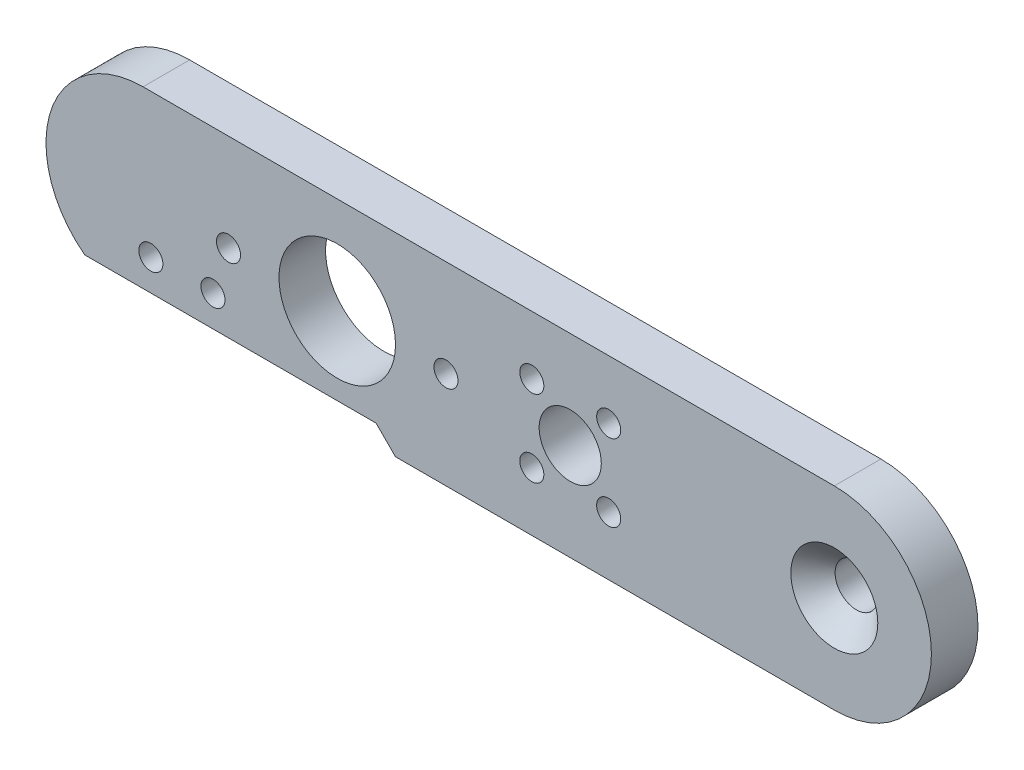
from build123d import *

# Parameters (mm, degrees)
SKETCH2_R                     = 4
SKETCH2_R_2                   = 1.55
SKETCH2_R_3                   = 7.5
BOSS_EXTRUDE1_DEPTH           = 6
CSK_FOR_M5_SFHCS1_D           = 5.5
CSK_FOR_M5_SFHCS1_CSINK_D     = 11.2
CSK_FOR_M5_SFHCS1_CSINK_ANGLE = 90
SKETCH6_R                     = 1.55
CUT_EXTRUDE1_DEPTH            = 3
SKETCH7_R                     = 3
CUT_EXTRUDE2_DEPTH            = 59.49909717


with BuildPart() as part:
    # Sketch2 → Boss-Extrude1 (new body)
    with BuildSketch(Plane.XY):
        with BuildLine():
            Line((-44.569206843, 12.5), (44.430793157, 12.5))
            ThreePointArc((44.430793157, 12.5), (56.930793157, 0), (44.430793157, -12.5))
            Line((44.430793157, -12.5), (-12.069206843, -12.5))
            Line((-12.069206843, -12.5), (-14.569206843, -10))
            Line((-14.569206843, -10), (-52.069206843, -10))
            ThreePointArc((-52.069206843, -10), (-56.427748069, 3.952847075), (-44.569206843, 12.5))
        make_face()
        with Locations((10.430793157, 0)):
            Circle(SKETCH2_R, mode=Mode.SUBTRACT)
        with Locations((15.380540625, 4.949747468)):
            Circle(SKETCH2_R_2, mode=Mode.SUBTRACT)
        with Locations((15.380540625, -4.949747468)):
            Circle(SKETCH2_R_2, mode=Mode.SUBTRACT)
        with Locations((5.481045689, -4.949747468)):
            Circle(SKETCH2_R_2, mode=Mode.SUBTRACT)
        with Locations((5.481045689, 4.949747468)):
            Circle(SKETCH2_R_2, mode=Mode.SUBTRACT)
        with Locations((-19.569206843, 0)):
            Circle(SKETCH2_R_3, mode=Mode.SUBTRACT)
        with Locations((-5.569206843, 0)):
            Circle(SKETCH2_R_2, mode=Mode.SUBTRACT)
        with Locations((-33.569206843, 0)):
            Circle(SKETCH2_R_2, mode=Mode.SUBTRACT)
    extrude(amount=BOSS_EXTRUDE1_DEPTH)

    # CSK for M5 SFHCS1 (through all)
    with Locations(Plane(origin=(44.430793157, 0, 6), x_dir=(1, 0, 0), z_dir=(0, 0, 1))):
        with Locations((0, 0)):
            CounterSinkHole(CSK_FOR_M5_SFHCS1_D / 2, CSK_FOR_M5_SFHCS1_CSINK_D / 2, counter_sink_angle=CSK_FOR_M5_SFHCS1_CSINK_ANGLE)

    # Sketch6 → Cut-Extrude1 (cut)
    with BuildSketch(Plane.XY.offset(6)):
        with Locations((-35.569206843, -6)):
            Circle(SKETCH6_R)
        with Locations((-43.569206843, -6)):
            Circle(SKETCH6_R)
    extrude(amount=-CUT_EXTRUDE1_DEPTH, mode=Mode.SUBTRACT)

    # Sketch7 → Cut-Extrude2 (cut, through all)
    with BuildSketch(Plane.XY.offset(3)):
        with Locations((-35.569206843, -6)):
            Circle(SKETCH7_R)
        with Locations((-43.569206843, -6)):
            Circle(SKETCH7_R)
    extrude(amount=-CUT_EXTRUDE2_DEPTH, mode=Mode.SUBTRACT)


solid = part.part
